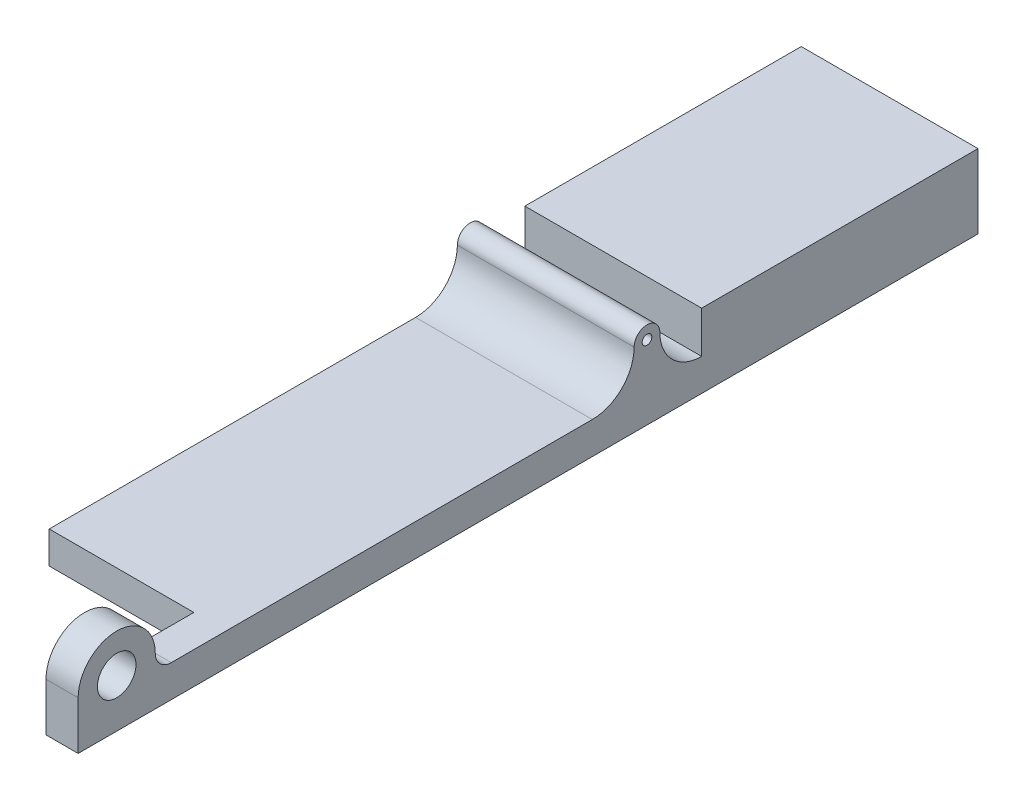
from build123d import *

# Parameters (mm, degrees)
SKETCH1_R           = 6
SKETCH1_R_2         = 1.5
BOSS_EXTRUDE1_DEPTH = 55
SKETCH2_W           = 45
SKETCH2_H           = 46
CUT_EXTRUDE1_DEPTH  = 290.556557515


with BuildPart() as part:
    # Sketch1 → Boss-Extrude1 (new body)
    with BuildSketch(Plane(origin=(0, 0, 0), x_dir=(0, 0, -1), z_dir=(1, 0, 0))):
        with BuildLine():
            Line((3, 15), (3, 0))
            Line((3, 0), (283, 0))
            Line((283, 0), (283, 23))
            Line((283, 23), (197, 23))
            Line((197, 23), (197, 10))
            ThreePointArc((197, 10), (187.807611845, 13.807611845), (184, 23))
            ThreePointArc((184, 23), (180, 27), (176, 23))
            ThreePointArc((176, 23), (172.192388155, 13.807611845), (163, 10))
            Line((163, 10), (32, 10))
            ThreePointArc((32, 10), (28.464466094, 11.464466094), (27, 15))
            ThreePointArc((27, 15), (23.485281374, 23.485281374), (15, 27))
            ThreePointArc((15, 27), (6.514718626, 23.485281374), (3, 15))
        make_face()
        with Locations((15, 15)):
            Circle(SKETCH1_R, mode=Mode.SUBTRACT)
        with Locations((180, 23)):
            Circle(SKETCH1_R_2, mode=Mode.SUBTRACT)
    extrude(amount=BOSS_EXTRUDE1_DEPTH)

    # Sketch2 → Cut-Extrude1 (cut, through all)
    with BuildSketch(Plane.XZ):
        with Locations((22.5, -26)):
            Rectangle(SKETCH2_W, SKETCH2_H)
    extrude(amount=-CUT_EXTRUDE1_DEPTH, mode=Mode.SUBTRACT)


solid = part.part
